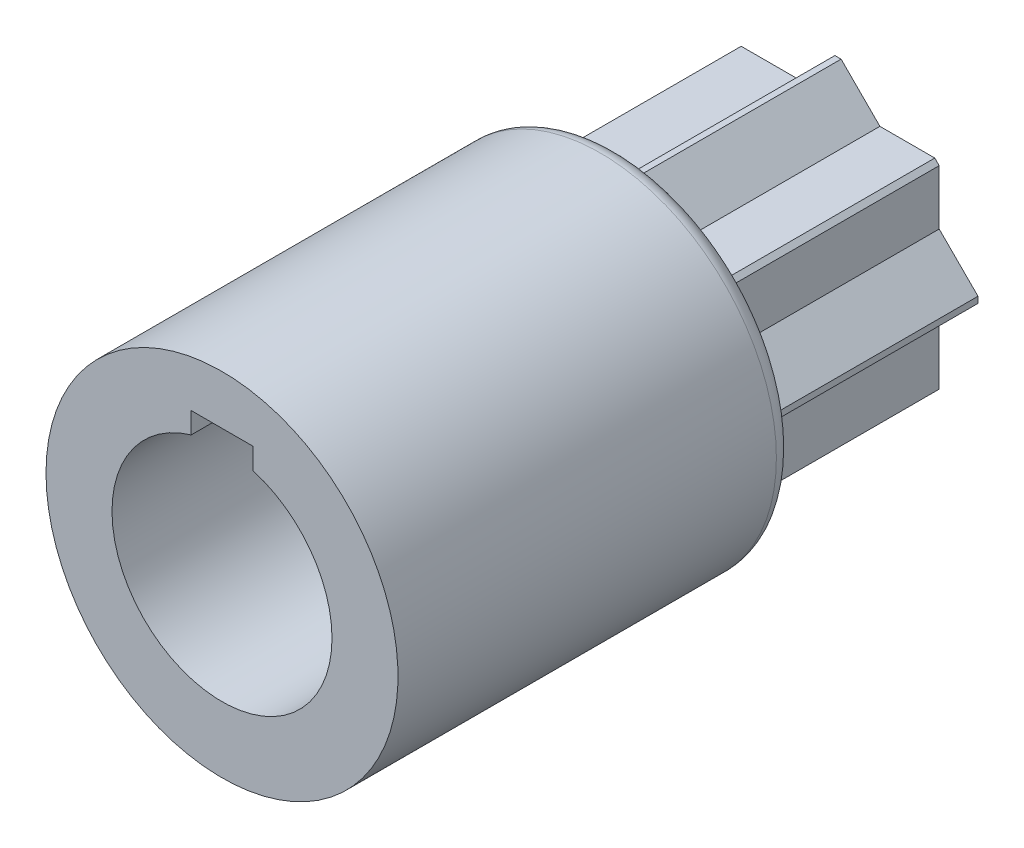
from build123d import *

# Parameters (mm, degrees)
BOSS_EXTRUDE1_DEPTH = 50
SKETCH2_R           = 40
BOSS_EXTRUDE2_DEPTH = 90
SKETCH3_R           = 25
CUT_EXTRUDE1_DEPTH  = 67
SKETCH4_W           = 14
SKETCH4_H           = 28.8
CUT_EXTRUDE2_DEPTH  = 65
FILLET1_R           = 4
CHAMFER1_SIZE       = 0.5


with BuildPart() as part:
    # Sketch1 → Boss-Extrude1 (new body)
    with BuildSketch(Plane.XY):
        Polygon((0.707106781, -31.819805153), (9.526911935, -23), (22, -23), (23, -22), (23, -9.526911935), (31.819805153, -0.707106781), (31.819805153, 0.707106781), (23, 9.526911935), (23, 22), (22, 23), (9.526911935, 23), (0.707106781, 31.819805153), (-0.707106781, 31.819805153), (-9.526911935, 23), (-22, 23), (-23, 22), (-23, 9.526911935), (-31.819805153, 0.707106781), (-31.819805153, -0.707106781), (-23, -9.526911935), (-23, -22), (-22, -23), (-9.526911935, -23), (-0.707106781, -31.819805153), align=None)
    extrude(amount=BOSS_EXTRUDE1_DEPTH)

    # Sketch2 → Boss-Extrude2 (add)
    with BuildSketch(Plane.XY.offset(50)):
        with Locations(Location((0, 0, 0), (0, 0, 180))):
            Circle(SKETCH2_R)
    extrude(amount=BOSS_EXTRUDE2_DEPTH)

    # Sketch3 → Cut-Extrude1 (cut)
    with BuildSketch(Plane.XY.offset(140)):
        Circle(SKETCH3_R)
    extrude(amount=-CUT_EXTRUDE1_DEPTH, mode=Mode.SUBTRACT)

    # Sketch4 → Cut-Extrude2 (cut)
    with BuildSketch(Plane.XY.offset(140)):
        with Locations((0, 14.4)):
            Rectangle(SKETCH4_W, SKETCH4_H)
    extrude(amount=-CUT_EXTRUDE2_DEPTH, mode=Mode.SUBTRACT)

    # Fillet1
    fillet1_edges = [part.edges().sort_by_distance(p)[0] for p in [
        (40, 0, 50),
    ]]
    fillet(fillet1_edges, radius=FILLET1_R)

    # Chamfer1
    chamfer1_edges = [part.edges().sort_by_distance(p)[0] for p in [
        (-25, 0, 73),
    ]]
    chamfer(chamfer1_edges, length=CHAMFER1_SIZE)


solid = part.part
